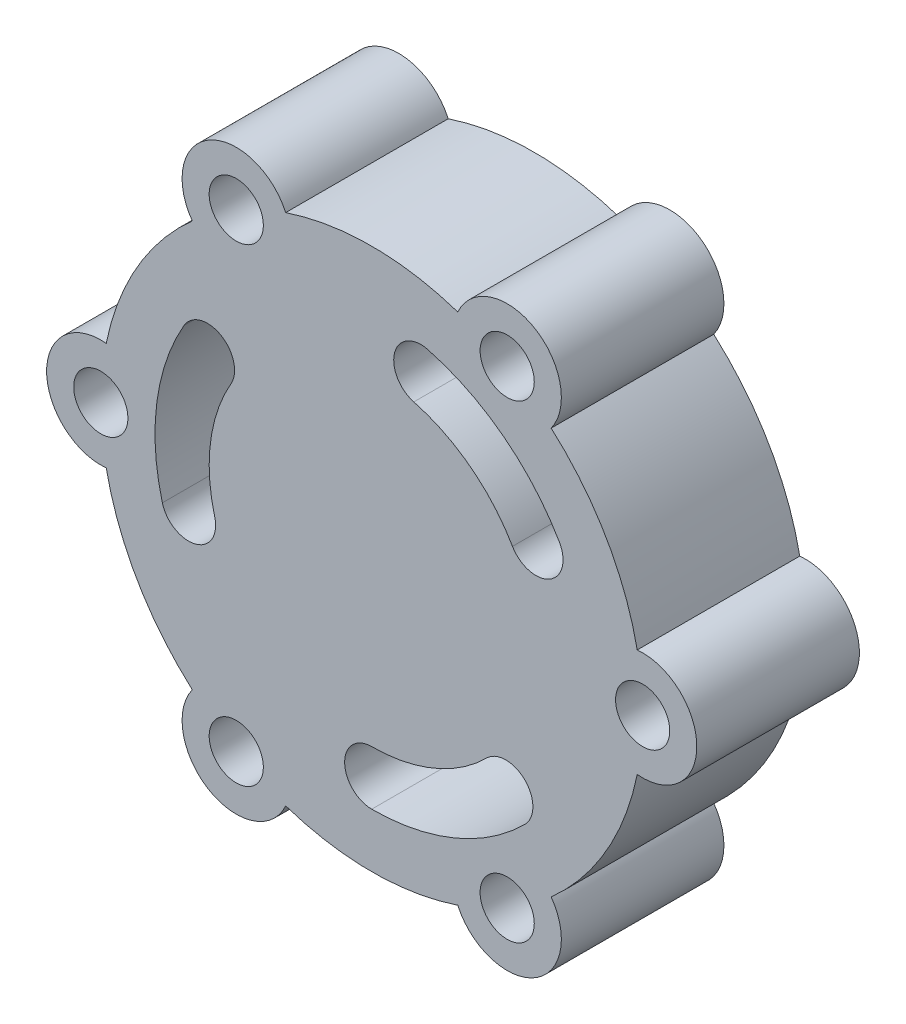
from build123d import *

# Parameters (mm, degrees)
SKETCH1_R           = 5
BOSS_EXTRUDE1_DEPTH = 30


with BuildPart() as part:
    # Sketch1 → Boss-Extrude1 (new body)
    with BuildSketch(Plane.XY):
        with BuildLine():
            ThreePointArc((21, 60.050125629), (26.698729811, 45), (36.88315603, 32.5396924))
            ThreePointArc((36.88315603, 32.5396924), (40, 18.038475773), (54.11684397, 22.589818029))
            ThreePointArc((54.11684397, 22.589818029), (70, 20), (85.88315603, 22.589818029))
            ThreePointArc((85.88315603, 22.589818029), (100, 18.038475773), (103.11684397, 32.5396924))
            ThreePointArc((103.11684397, 32.5396924), (113.301270189, 45), (119, 60.050125629))
            ThreePointArc((119, 60.050125629), (130, 70), (119, 79.949874371))
            ThreePointArc((119, 79.949874371), (113.301270189, 95), (103.11684397, 107.4603076))
            ThreePointArc((103.11684397, 107.4603076), (100, 121.961524227), (85.88315603, 117.410181971))
            ThreePointArc((85.88315603, 117.410181971), (70, 120), (54.11684397, 117.410181971))
            ThreePointArc((54.11684397, 117.410181971), (40, 121.961524227), (36.88315603, 107.4603076))
            ThreePointArc((36.88315603, 107.4603076), (26.698729811, 95), (21, 79.949874371))
            ThreePointArc((21, 79.949874371), (10, 70), (21, 60.050125629))
        make_face()
        with Locations((20, 70)):
            Circle(SKETCH1_R, mode=Mode.SUBTRACT)
        with Locations((45, 26.698729811)):
            Circle(SKETCH1_R, mode=Mode.SUBTRACT)
        with Locations((95, 26.698729811)):
            Circle(SKETCH1_R, mode=Mode.SUBTRACT)
        with Locations((120, 70)):
            Circle(SKETCH1_R, mode=Mode.SUBTRACT)
        with Locations((95, 113.301270189)):
            Circle(SKETCH1_R, mode=Mode.SUBTRACT)
        with Locations((45, 113.301270189)):
            Circle(SKETCH1_R, mode=Mode.SUBTRACT)
        with BuildLine():
            ThreePointArc((104.641016151, 90), (94.35045716, 101.734133612), (80.352761804, 108.637033052))
            ThreePointArc((80.352761804, 108.637033052), (74.229037447, 105.101499146), (77.764571353, 98.977774789))
            ThreePointArc((77.764571353, 98.977774789), (88.26284287, 93.800600209), (95.980762114, 85))
            ThreePointArc((95.980762114, 85), (102.810889132, 83.169872981), (104.641016151, 90))
        make_face(mode=Mode.SUBTRACT)
        with BuildLine():
            ThreePointArc((70, 30), (85.307337295, 33.0448187), (98.284271247, 41.715728753))
            ThreePointArc((98.284271247, 41.715728753), (98.284271247, 48.786796564), (91.213203436, 48.786796564))
            ThreePointArc((91.213203436, 48.786796564), (81.480502971, 42.283614025), (70, 40))
            ThreePointArc((70, 40), (65, 35), (70, 30))
        make_face(mode=Mode.SUBTRACT)
        with BuildLine():
            ThreePointArc((35.358983849, 90), (30.342205545, 75.221047689), (31.362966948, 59.647238196))
            ThreePointArc((31.362966948, 59.647238196), (37.486691305, 56.11170429), (41.022225211, 62.235428647))
            ThreePointArc((41.022225211, 62.235428647), (40.256654159, 73.915785767), (44.019237886, 85))
            ThreePointArc((44.019237886, 85), (42.189110868, 91.830127019), (35.358983849, 90))
        make_face(mode=Mode.SUBTRACT)
    extrude(amount=BOSS_EXTRUDE1_DEPTH)


solid = part.part
